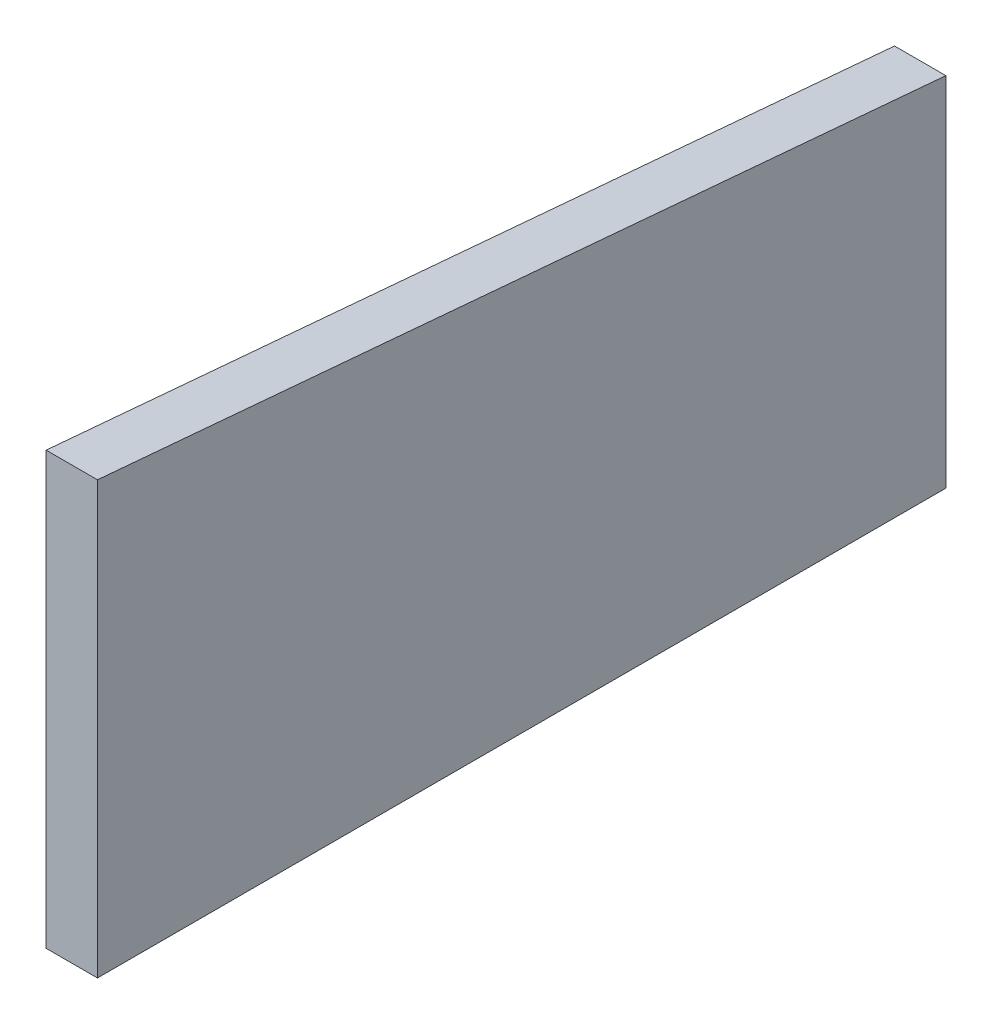
from build123d import *

# Parameters (mm, degrees)
BOSS_EXTRUDE1_DEPTH = 18.25625


with BuildPart() as part:
    # Sketch1 → Boss-Extrude1 (new body)
    with BuildSketch(Plane(origin=(0, 0, 0), x_dir=(0, 0, -1), z_dir=(1, 0, 0))):
        Polygon((0, 0), (301.625, 0), (301.625, 127), (0, 153.388768136), align=None)
    extrude(amount=BOSS_EXTRUDE1_DEPTH)


solid = part.part
